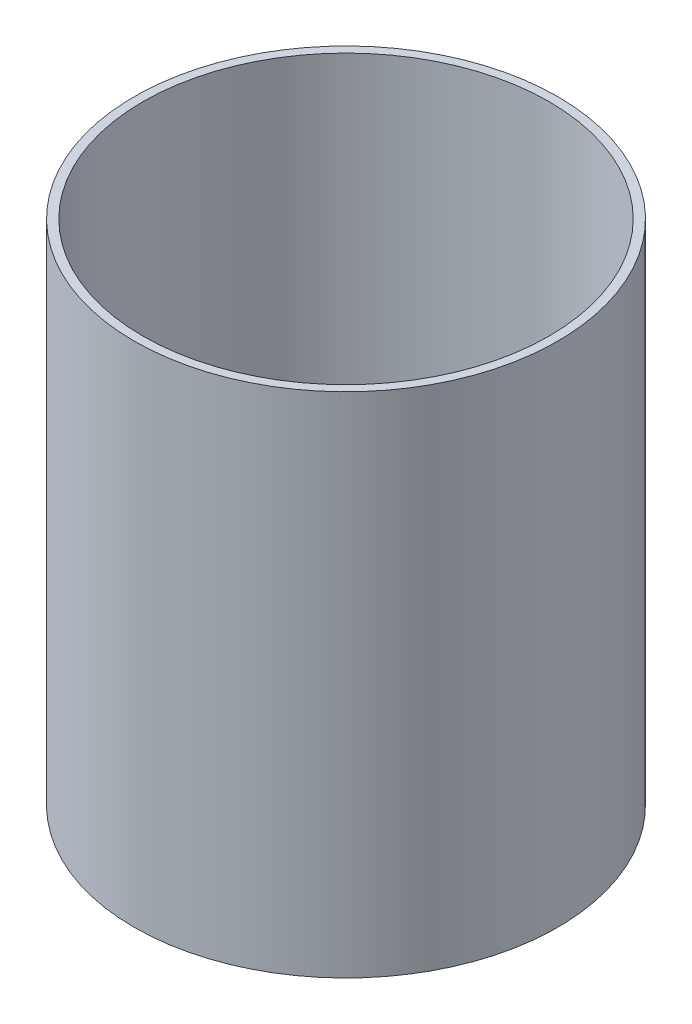
from build123d import *

# Parameters (mm, degrees)
SKETCH1_R           = 24.401
SKETCH1_R_2         = 23.401
BOSS_EXTRUDE1_DEPTH = 58.5


with BuildPart() as part:
    # Sketch1 → Boss-Extrude1 (new body)
    with BuildSketch(Plane(origin=(0, 0, 0), x_dir=(1, 0, 0), z_dir=(0, 1, 0))):
        with Locations(Location((-29.391570254, 2.611368154, 0), (0, 0, 90))):
            Circle(SKETCH1_R)
        with Locations(Location((-29.391570254, 2.611368154, 0), (0, 0, 90))):
            Circle(SKETCH1_R_2, mode=Mode.SUBTRACT)
    extrude(amount=BOSS_EXTRUDE1_DEPTH)


solid = part.part
